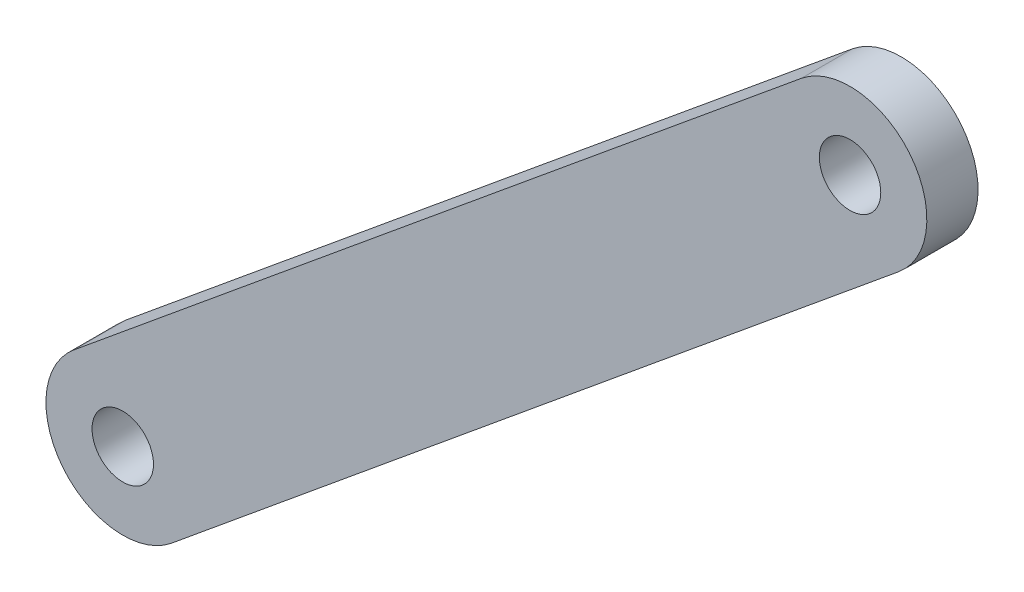
from build123d import *

# Parameters (mm, degrees)
BOSS_EXTRU_1_START      = -10
BOSS_EXTRU_1_DEPTH      = 5
ESQUISSE2_R             = 3
ENL_V_MAT_EXTRU_1_DEPTH = 5


with BuildPart() as part:
    # Esquisse1 → Boss.-Extru.1 (new body)
    with BuildSketch(Plane.XY.offset(BOSS_EXTRU_1_START)):
        with BuildLine():
            Line((24.767075252, -5.790077162), (-46.257871267, -64.266200254))
            ThreePointArc((-46.257871267, -64.266200254), (-56.815023681, -63.243198344), (-55.792021772, -52.68604593))
            Line((-55.792021772, -52.68604593), (15.232924748, 5.790077162))
            ThreePointArc((15.232924748, 5.790077162), (25.790077162, 4.767075252), (24.767075252, -5.790077162))
        make_face()
    extrude(amount=BOSS_EXTRU_1_DEPTH)

    # Esquisse2 → Enlèv. mat.-Extru.1 (cut)
    with BuildSketch(Plane.XY.offset(-5)):
        with Locations((20, 0)):
            Circle(ESQUISSE2_R)
        with Locations((-51.024946519, -58.476123092)):
            Circle(ESQUISSE2_R)
    extrude(amount=-ENL_V_MAT_EXTRU_1_DEPTH, mode=Mode.SUBTRACT)


solid = part.part
